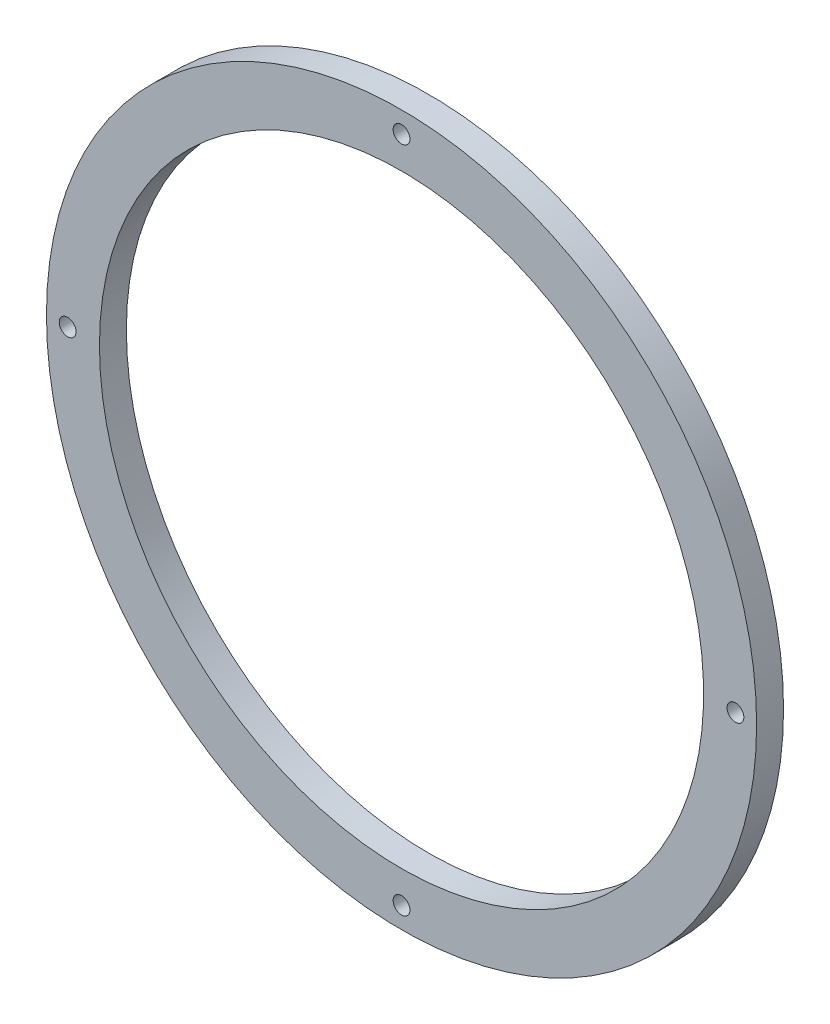
from build123d import *

# Parameters (mm, degrees)
SKETCH1_R           = 100.5
SKETCH1_R_2         = 85.5
SKETCH1_R_3         = 2.38125
BOSS_EXTRUDE1_DEPTH = 7.62


with BuildPart() as part:
    # Sketch1 → Boss-Extrude1 (new body)
    with BuildSketch(Plane.XY):
        with Locations(Location((0, 0, 0), (0, 0, 180))):
            Circle(SKETCH1_R)
        with Locations(Location((0, 0, 0), (0, 0, 180))):
            Circle(SKETCH1_R_2, mode=Mode.SUBTRACT)
        with Locations(Location((0, 94.5, 0), (0, 0, 180))):
            Circle(SKETCH1_R_3, mode=Mode.SUBTRACT)
        with Locations(Location((94.5, 0, 0), (0, 0, 180))):
            Circle(SKETCH1_R_3, mode=Mode.SUBTRACT)
        with Locations(Location((0, -94.5, 0), (0, 0, 180))):
            Circle(SKETCH1_R_3, mode=Mode.SUBTRACT)
        with Locations(Location((-94.5, 0, 0), (0, 0, 180))):
            Circle(SKETCH1_R_3, mode=Mode.SUBTRACT)
    extrude(amount=BOSS_EXTRUDE1_DEPTH)


solid = part.part
